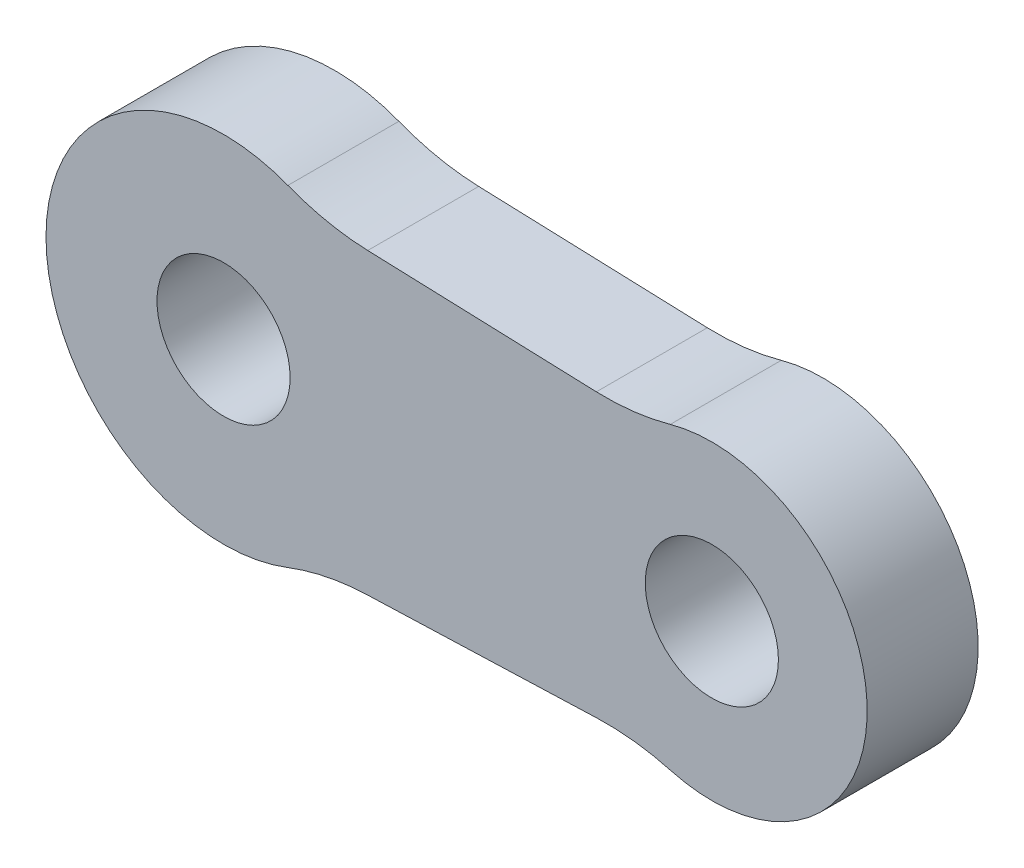
from build123d import *

# Parameters (mm, degrees)
SKETCH1_R           = 15
BOSS_EXTRUDE1_DEPTH = 25


with BuildPart() as part:
    # Sketch1 → Boss-Extrude1 (new body)
    with BuildSketch(Plane.XY):
        with BuildLine():
            Line((32.479900356, 33.578076695), (83.98708873, 31.756296404))
            ThreePointArc((83.98708873, 31.756296404), (92.388975978, 32.10235988), (100.639908058, 33.725193533))
            ThreePointArc((100.639908058, 33.725193533), (144.999962222, 0.051424621), (100.739051524, -33.75255299))
            ThreePointArc((100.739051524, -33.75255299), (92.560172775, -32.162876681), (84.235015326, -31.826897813))
            Line((84.235015326, -31.826897813), (32.228404177, -33.672986918))
            ThreePointArc((32.228404177, -33.672986918), (23.15787759, -34.75401642), (14.391377406, -37.321418199))
            ThreePointArc((14.391377406, -37.321418199), (-39.999961921, 0.05519344), (14.494317379, 37.281560639))
            ThreePointArc((14.494317379, 37.281560639), (23.331455891, 34.673906246), (32.479900356, 33.578076695))
        make_face()
        Circle(SKETCH1_R, mode=Mode.SUBTRACT)
        with Locations((110, 0)):
            Circle(SKETCH1_R, mode=Mode.SUBTRACT)
    extrude(amount=BOSS_EXTRUDE1_DEPTH)


solid = part.part
